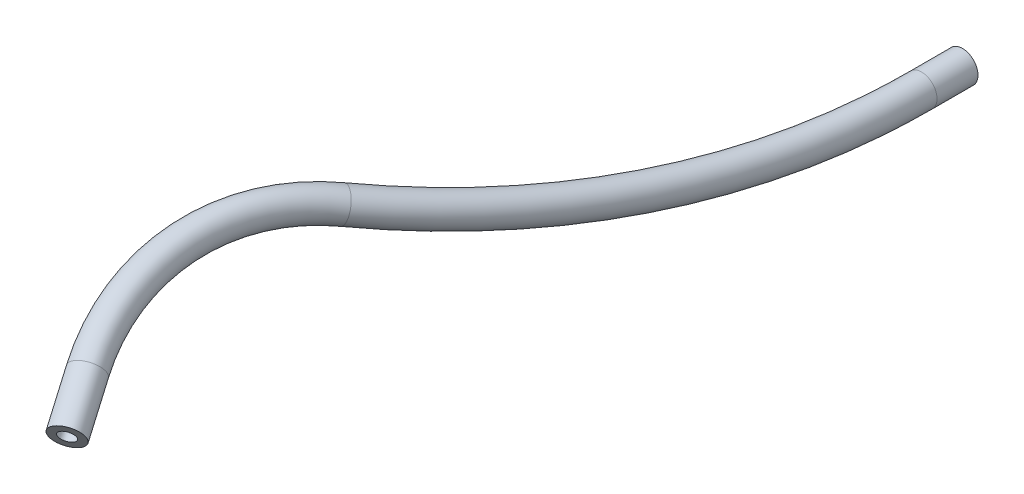
from build123d import *

# Parameters (mm, degrees)
SWEEP1_PROFILE_R     = 6.35
CUT_SWEEP1_PROFILE_R = 3.175


with BuildPart() as part:
    # Sweep1: sweep along a curve in space
    with BuildLine() as sweep1_path:
        Line((-25.144717139, 46.783, -16.764999998), (-25.144717139, 46.783, 0))
        ThreePointArc((-25.144717139, 46.783, 0), (-37.539812947, 54.270144781, 98.408776247), (-73.67428039, 76.09684088, 188.474744178))
        ThreePointArc((-77.762208871, 65.122942343, 288.925037219), (-87.944554744, 81.01650581, 239.339220312), (-73.67428039, 76.09684088, 188.474744178))
        Line((-68.87554044, 55.005914395, 306.16579471), (-77.762208871, 65.122942343, 288.925037219))
    # Sweep1 profile (on start of the path) → Sweep1 (sweep)
    with BuildSketch(Plane(origin=(-25.144717139, 46.783, -16.764999998), x_dir=(1, 0, 0), z_dir=(0, 0, 1))):
        Circle(SWEEP1_PROFILE_R)
    sweep(path=sweep1_path.line)

    # Cut-Sweep1: sweep along a curve in space
    with BuildLine() as cut_sweep1_path:
        Line((-25.144717139, 46.783, -16.764999998), (-25.144717139, 46.783, 0))
        ThreePointArc((-25.144717139, 46.783, 0), (-37.539812947, 54.270144781, 98.408776247), (-73.67428039, 76.09684088, 188.474744178))
        ThreePointArc((-77.762208871, 65.122942343, 288.925037219), (-87.944554744, 81.01650581, 239.339220312), (-73.67428039, 76.09684088, 188.474744178))
        Line((-68.87554044, 55.005914395, 306.16579471), (-77.762208871, 65.122942343, 288.925037219))
    # Cut-Sweep1 profile (on start of the path) → Cut-Sweep1 (sweep, cut)
    with BuildSketch(Plane(origin=(-25.144717139, 46.783, -16.764999998), x_dir=(1, 0, 0), z_dir=(0, 0, 1))):
        Circle(CUT_SWEEP1_PROFILE_R)
    sweep(path=cut_sweep1_path.line, mode=Mode.SUBTRACT)


solid = part.part
